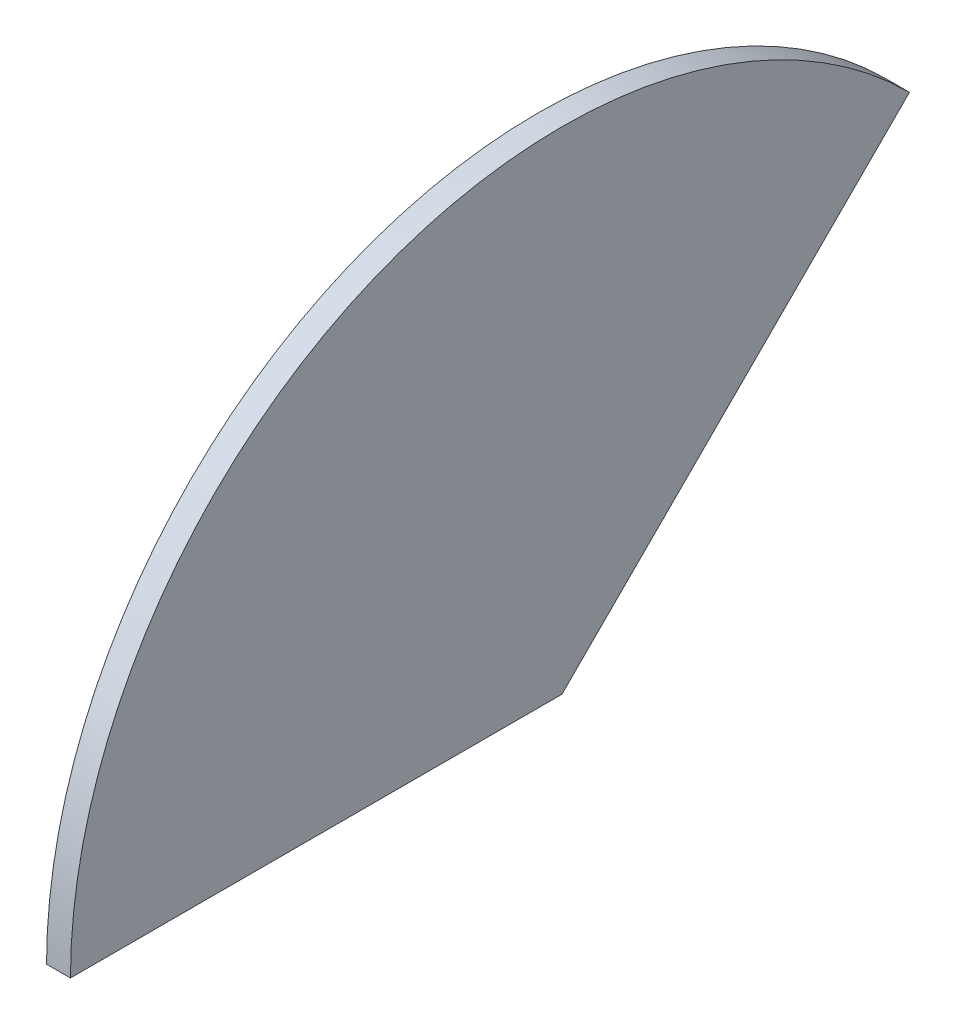
from build123d import *

# Parameters (mm, degrees)
EXTRUDE_1_DEPTH = 9


with BuildPart() as part:
    # 草图2 → 凸台-拉伸1 (new body)
    with BuildSketch(Plane(origin=(0, 0, 0), x_dir=(0, 0, -1), z_dir=(1, 0, 0))):
        with BuildLine():
            Line((0, 0), (-185, 0))
            ThreePointArc((-185, 0), (-70.796434988, 170.917713515), (130.81475452, 130.81475452))
            Line((130.81475452, 130.81475452), (0, 0))
        make_face()
    extrude(amount=EXTRUDE_1_DEPTH)


solid = part.part
